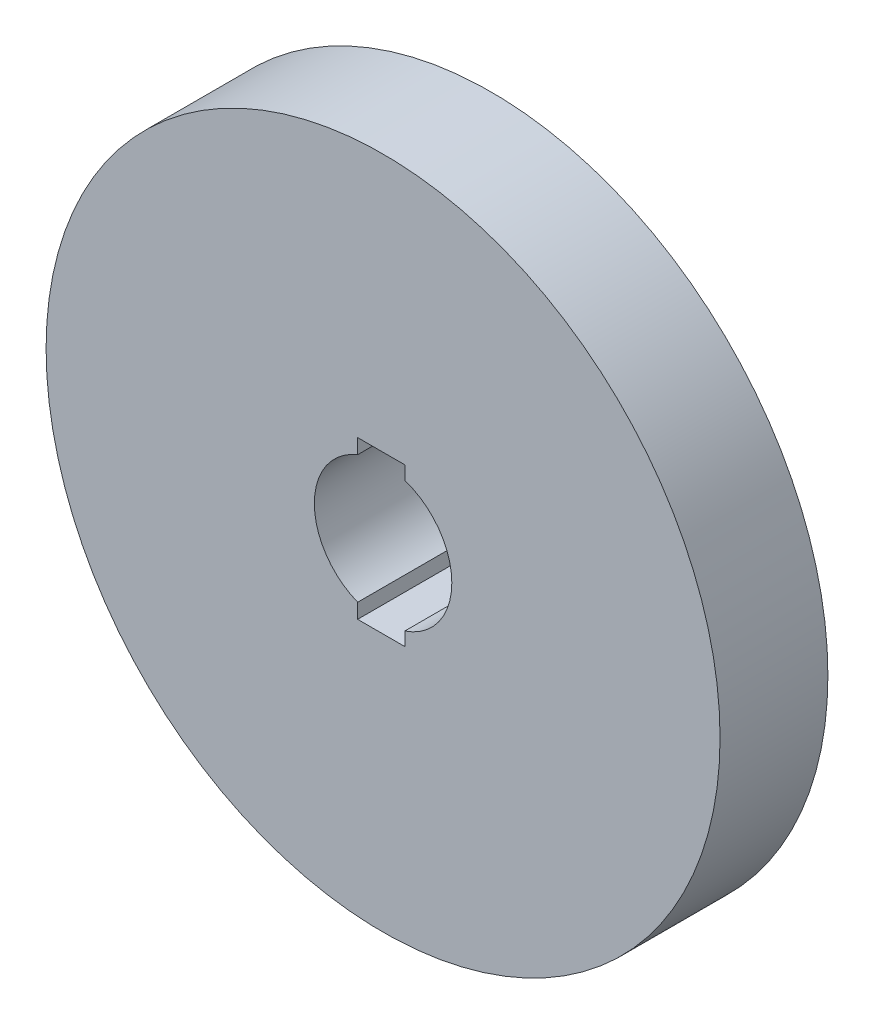
from build123d import *

# Parameters (mm, degrees)
SKETCH1_R           = 25
BOSS_EXTRUDE1_DEPTH = 8
CUT_EXTRUDE1_DEPTH  = 37.249137921


with BuildPart() as part:
    # Sketch1 → Boss-Extrude1 (new body)
    with BuildSketch(Plane(origin=(0, 0, 0), x_dir=(0, 1, 0), z_dir=(0, 0, 1))):
        with Locations(Location((0, 0, 0), (0, 0, 270))):
            Circle(SKETCH1_R)
    extrude(amount=BOSS_EXTRUDE1_DEPTH)

    # Sketch2 → Cut-Extrude1 (cut, through all)
    with BuildSketch(Plane.XY.offset(8)):
        with BuildLine():
            Line((-1.886299685, 4.738340796), (-1.886299685, 5.838340796))
            Line((-1.886299685, 5.838340796), (1.612593669, 5.838340796))
            Line((1.612593669, 5.838340796), (1.612593669, 4.838340796))
            ThreePointArc((1.612593669, 4.838340796), (5.1, 0), (1.612593669, -4.838340796))
            Line((1.612593669, -4.838340796), (1.612593669, -5.838340796))
            Line((1.612593669, -5.838340796), (-1.886299685, -5.838340796))
            Line((-1.886299685, -5.838340796), (-1.886299685, -4.738340796))
            ThreePointArc((-1.886299685, -4.738340796), (-5.1, 0), (-1.886299685, 4.738340796))
        make_face()
    extrude(amount=-CUT_EXTRUDE1_DEPTH, mode=Mode.SUBTRACT)


solid = part.part
